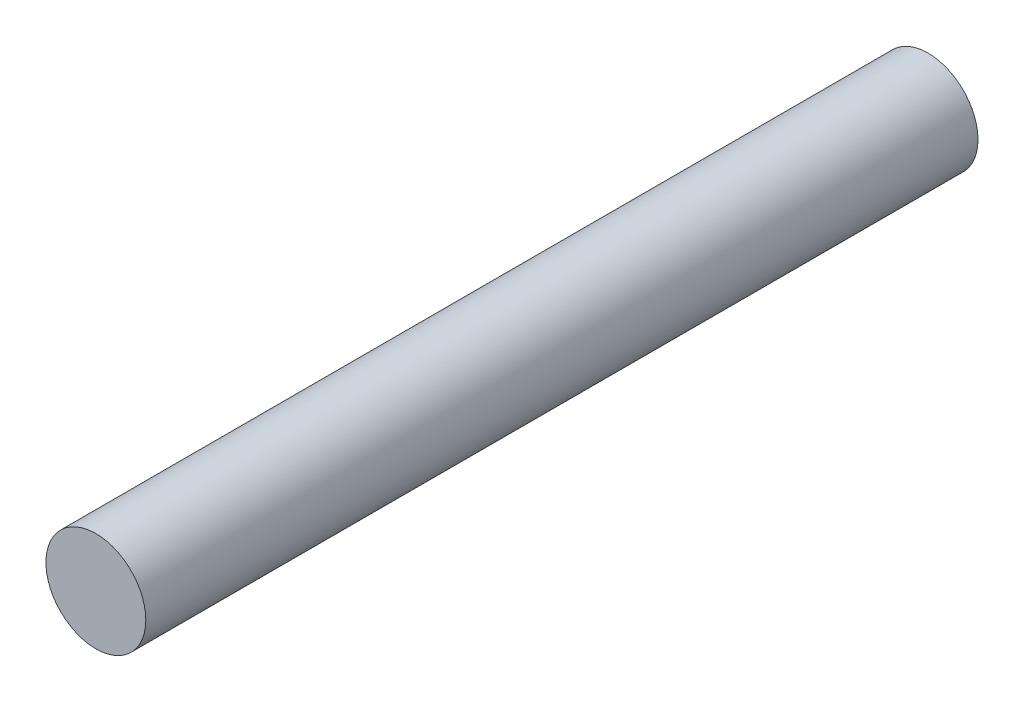
from build123d import *

# Parameters (mm, degrees)
ESBO_O1_R                = 3
RESSALTO_EXTRUS_O1_DEPTH = 50


with BuildPart() as part:
    # Esboço1 → Ressalto-extrusão1 (new body)
    with BuildSketch(Plane.XY):
        Circle(ESBO_O1_R)
    extrude(amount=RESSALTO_EXTRUS_O1_DEPTH)


solid = part.part
